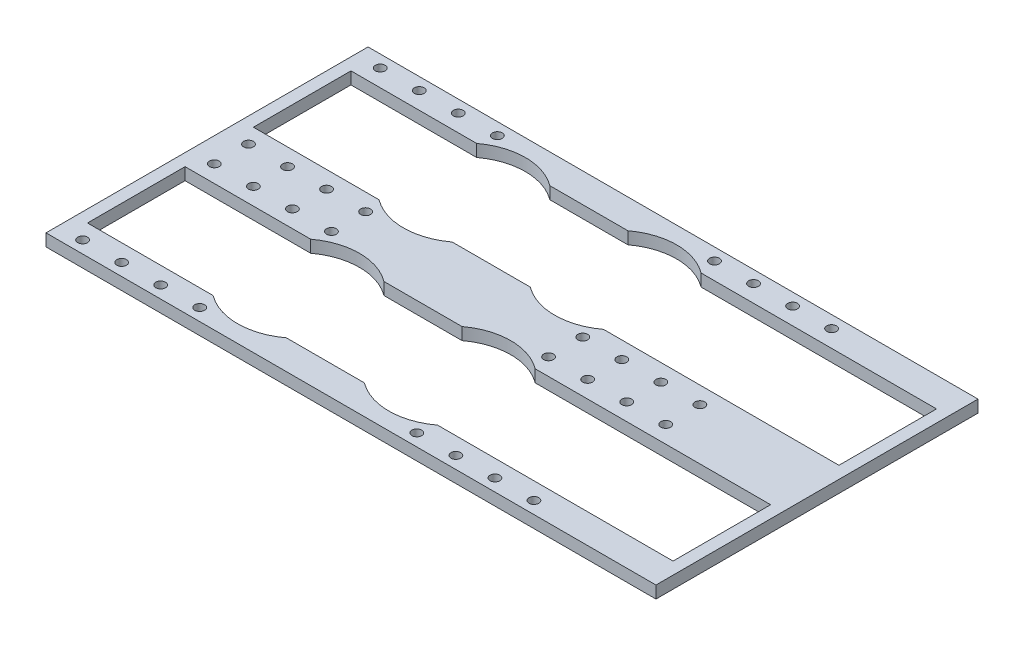
from build123d import *

# Parameters (mm, degrees)
SKETCH1_W           = 160
SKETCH1_H           = 66
BOSS_EXTRUDE1_DEPTH = 40
SKETCH2_R           = 4
SKETCH2_W           = 130
SKETCH2_H           = 37.5
CUT_EXTRUDE1_DEPTH  = 112.157545853
SKETCH3_R           = 1
SKETCH3_W           = 120
SKETCH3_H           = 20
CUT_EXTRUDE2_DEPTH  = 96.336247042
SKETCH4_R           = 12.5
CUT_EXTRUDE3_DEPTH  = 95.314633011
SKETCH5_W           = 35
SKETCH5_H           = 66
CUT_EXTRUDE4_DEPTH  = 96.336247042


with BuildPart() as part:
    # Sketch1 → Boss-Extrude1 (new body)
    with BuildSketch(Plane(origin=(0, 0, 0), x_dir=(1, 0, 0), z_dir=(0, 1, 0))):
        Rectangle(SKETCH1_W, SKETCH1_H)
    extrude(amount=BOSS_EXTRUDE1_DEPTH)

    # Sketch2 → Cut-Extrude1 (cut, through all)
    with BuildSketch(Plane.XY.offset(33)):
        with Locations((70, 20)):
            Circle(SKETCH2_R)
        with Locations((-15, 21.25)):
            Rectangle(SKETCH2_W, SKETCH2_H)
    extrude(amount=-CUT_EXTRUDE1_DEPTH, mode=Mode.SUBTRACT)

    # Sketch3 → Cut-Extrude2 (cut, through all)
    with BuildSketch(Plane(origin=(0, 40, 0), x_dir=(1, 0, 0), z_dir=(0, 1, 0))):
        with Locations(Location((-75, 30.5, 0), (0, 0, 270))):
            Circle(SKETCH3_R)
        with Locations(Location((-75, 3.5, 0), (0, 0, 270))):
            Circle(SKETCH3_R)
        with Locations(Location((-67, 30.5, 0), (0, 0, 270))):
            Circle(SKETCH3_R)
        with Locations(Location((-59, 30.5, 0), (0, 0, 270))):
            Circle(SKETCH3_R)
        with Locations(Location((-51, 30.5, 0), (0, 0, 270))):
            Circle(SKETCH3_R)
        with Locations(Location((-67, 3.5, 0), (0, 0, 270))):
            Circle(SKETCH3_R)
        with Locations(Location((-59, 3.5, 0), (0, 0, 270))):
            Circle(SKETCH3_R)
        with Locations(Location((-51, 3.5, 0), (0, 0, 270))):
            Circle(SKETCH3_R)
        with Locations(Location((-6.5, 30.5, 0), (0, 0, 270))):
            Circle(SKETCH3_R)
        with Locations(Location((-6.5, 3.5, 0), (0, 0, 270))):
            Circle(SKETCH3_R)
        with Locations(Location((1.5, 30.5, 0), (0, 0, 270))):
            Circle(SKETCH3_R)
        with Locations(Location((9.5, 30.5, 0), (0, 0, 270))):
            Circle(SKETCH3_R)
        with Locations(Location((17.5, 30.5, 0), (0, 0, 270))):
            Circle(SKETCH3_R)
        with Locations(Location((1.5, 3.5, 0), (0, 0, 270))):
            Circle(SKETCH3_R)
        with Locations(Location((9.5, 3.5, 0), (0, 0, 270))):
            Circle(SKETCH3_R)
        with Locations(Location((17.5, 3.5, 0), (0, 0, 270))):
            Circle(SKETCH3_R)
        with Locations((17.5, -3.5)):
            Circle(SKETCH3_R)
        with Locations((9.5, -3.5)):
            Circle(SKETCH3_R)
        with Locations((1.5, -3.5)):
            Circle(SKETCH3_R)
        with Locations((17.5, -30.5)):
            Circle(SKETCH3_R)
        with Locations((9.5, -30.5)):
            Circle(SKETCH3_R)
        with Locations((1.5, -30.5)):
            Circle(SKETCH3_R)
        with Locations((-6.5, -3.5)):
            Circle(SKETCH3_R)
        with Locations((-6.5, -30.5)):
            Circle(SKETCH3_R)
        with Locations((-51, -3.5)):
            Circle(SKETCH3_R)
        with Locations((-59, -3.5)):
            Circle(SKETCH3_R)
        with Locations((-67, -3.5)):
            Circle(SKETCH3_R)
        with Locations((-51, -30.5)):
            Circle(SKETCH3_R)
        with Locations((-59, -30.5)):
            Circle(SKETCH3_R)
        with Locations((-67, -30.5)):
            Circle(SKETCH3_R)
        with Locations((-75, -3.5)):
            Circle(SKETCH3_R)
        with Locations((-75, -30.5)):
            Circle(SKETCH3_R)
        with Locations((-17.5, 17)):
            Rectangle(SKETCH3_W, SKETCH3_H)
        with Locations((-17.5, -17)):
            Rectangle(SKETCH3_W, SKETCH3_H)
    extrude(amount=-CUT_EXTRUDE2_DEPTH, mode=Mode.SUBTRACT)

    # Sketch4 → Cut-Extrude3 (cut, through all)
    with BuildSketch(Plane(origin=(0, 2.5, 0), x_dir=(1, 0, 0), z_dir=(0, 1, 0))):
        with Locations((-44.25, -17)):
            Circle(SKETCH4_R)
        with Locations((-44.25, 17)):
            Circle(SKETCH4_R)
        with Locations((-13.25, 17)):
            Circle(SKETCH4_R)
        with Locations((-13.25, -17)):
            Circle(SKETCH4_R)
    extrude(amount=-CUT_EXTRUDE3_DEPTH, mode=Mode.SUBTRACT)

    # Sketch5 → Cut-Extrude4 (cut, through all)
    with BuildSketch(Plane(origin=(0, 40, 0), x_dir=(1, 0, 0), z_dir=(0, 1, 0))):
        with Locations((62.5, 0)):
            Rectangle(SKETCH5_W, SKETCH5_H)
    extrude(amount=-CUT_EXTRUDE4_DEPTH, mode=Mode.SUBTRACT)


solid = part.part
